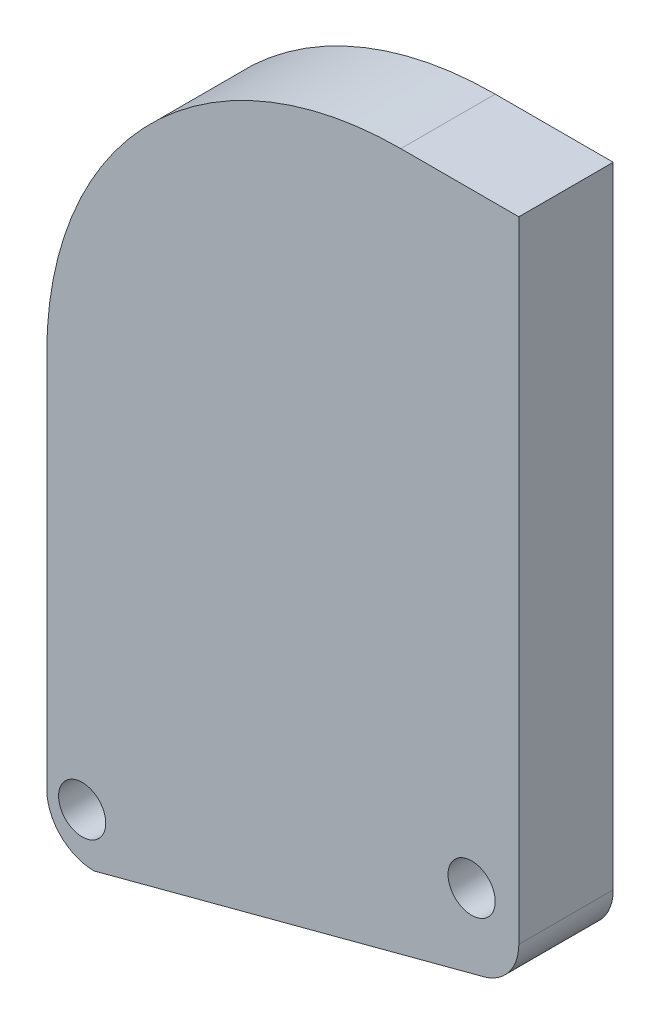
from build123d import *

# Parameters (mm, degrees)
SKETCH1_R           = 1
BOSS_EXTRUDE1_DEPTH = 4


with BuildPart() as part:
    # Sketch1 → Boss-Extrude1 (new body)
    with BuildSketch(Plane.XY):
        with BuildLine():
            Line((0, 0), (-5, 0))
            ThreePointArc((-5, 0), (-15.606601718, -4.393398282), (-20, -15))
            Line((-20, -15), (-20, -31))
            ThreePointArc((-20, -31), (-19.414213562, -32.414213562), (-18, -33))
            Line((-18, -33), (-1.488039242, -28.627581694))
            ThreePointArc((-1.488039242, -28.627581694), (-0.415083359, -27.914069878), (0, -26.694217739))
            Line((0, -26.694217739), (0, 0))
        make_face()
        with Locations((-18.5, -31)):
            Circle(SKETCH1_R, mode=Mode.SUBTRACT)
        with Locations((-2, -25.628432728)):
            Circle(SKETCH1_R, mode=Mode.SUBTRACT)
    extrude(amount=BOSS_EXTRUDE1_DEPTH)


solid = part.part
